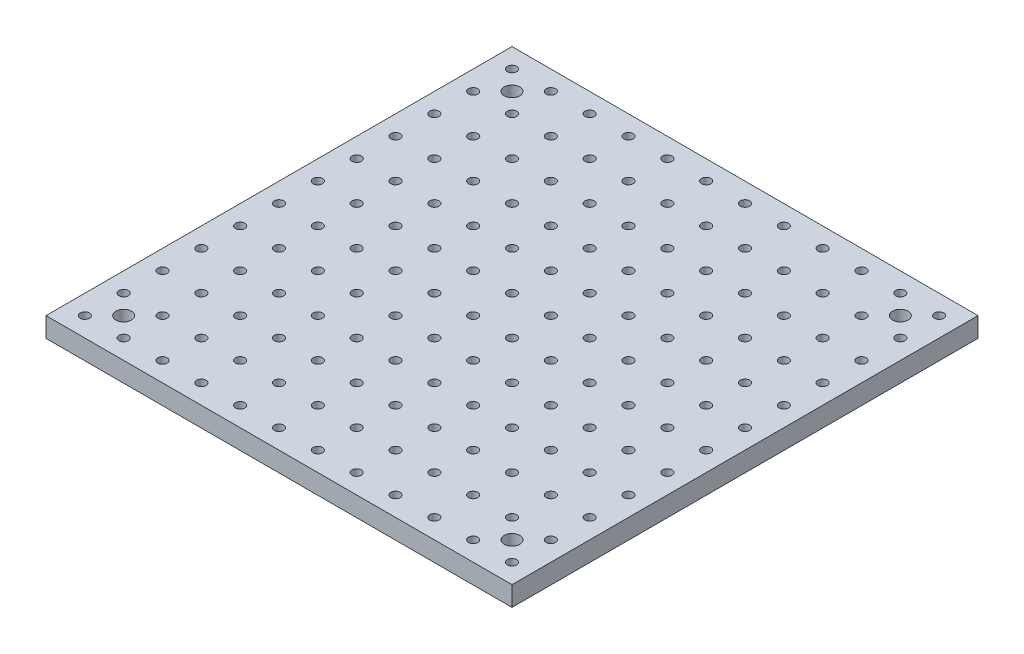
from build123d import *

# Parameters (mm, degrees)
SKETCH1_W           = 300
SKETCH1_H           = 300
BOSS_EXTRUDE1_DEPTH = 12.7
SKETCH2_R           = 3
SKETCH2_R_2         = 5
CUT_EXTRUDE1_DEPTH  = 12.7


with BuildPart() as part:
    # Sketch1 → Boss-Extrude1 (new body)
    with BuildSketch(Plane(origin=(0, 0, 0), x_dir=(1, 0, 0), z_dir=(0, 1, 0))):
        Rectangle(SKETCH1_W, SKETCH1_H)
    extrude(amount=BOSS_EXTRUDE1_DEPTH)

    # Sketch2 → Cut-Extrude1 (cut)
    with BuildSketch(Plane(origin=(0, 12.7, 0), x_dir=(1, 0, 0), z_dir=(0, 1, 0))):
        with Locations(Location((-137.5, -137.5, 0), (0, 0, 270))):
            Circle(SKETCH2_R)
        with Locations(Location((-112.5, -137.5, 0), (0, 0, 270))):
            Circle(SKETCH2_R)
        with Locations(Location((-87.5, -137.5, 0), (0, 0, 270))):
            Circle(SKETCH2_R)
        with Locations(Location((-62.5, -137.5, 0), (0, 0, 270))):
            Circle(SKETCH2_R)
        with Locations(Location((-37.5, -137.5, 0), (0, 0, 270))):
            Circle(SKETCH2_R)
        with Locations(Location((-12.5, -137.5, 0), (0, 0, 270))):
            Circle(SKETCH2_R)
        with Locations(Location((12.5, -137.5, 0), (0, 0, 270))):
            Circle(SKETCH2_R)
        with Locations(Location((37.5, -137.5, 0), (0, 0, 270))):
            Circle(SKETCH2_R)
        with Locations(Location((62.5, -137.5, 0), (0, 0, 270))):
            Circle(SKETCH2_R)
        with Locations(Location((87.5, -137.5, 0), (0, 0, 270))):
            Circle(SKETCH2_R)
        with Locations(Location((112.5, -137.5, 0), (0, 0, 270))):
            Circle(SKETCH2_R)
        with Locations(Location((137.5, -137.5, 0), (0, 0, 270))):
            Circle(SKETCH2_R)
        with Locations(Location((-112.5, -112.5, 0), (0, 0, 270))):
            Circle(SKETCH2_R)
        with Locations(Location((-87.5, -112.5, 0), (0, 0, 270))):
            Circle(SKETCH2_R)
        with Locations(Location((-62.5, -112.5, 0), (0, 0, 270))):
            Circle(SKETCH2_R)
        with Locations(Location((-37.5, -112.5, 0), (0, 0, 270))):
            Circle(SKETCH2_R)
        with Locations(Location((-12.5, -112.5, 0), (0, 0, 270))):
            Circle(SKETCH2_R)
        with Locations(Location((12.5, -112.5, 0), (0, 0, 270))):
            Circle(SKETCH2_R)
        with Locations(Location((37.5, -112.5, 0), (0, 0, 270))):
            Circle(SKETCH2_R)
        with Locations(Location((62.5, -112.5, 0), (0, 0, 270))):
            Circle(SKETCH2_R)
        with Locations(Location((87.5, -112.5, 0), (0, 0, 270))):
            Circle(SKETCH2_R)
        with Locations(Location((112.5, -112.5, 0), (0, 0, 270))):
            Circle(SKETCH2_R)
        with Locations(Location((137.5, -112.5, 0), (0, 0, 270))):
            Circle(SKETCH2_R)
        with Locations(Location((-112.5, -87.5, 0), (0, 0, 270))):
            Circle(SKETCH2_R)
        with Locations(Location((-87.5, -87.5, 0), (0, 0, 270))):
            Circle(SKETCH2_R)
        with Locations(Location((-62.5, -87.5, 0), (0, 0, 270))):
            Circle(SKETCH2_R)
        with Locations(Location((-37.5, -87.5, 0), (0, 0, 270))):
            Circle(SKETCH2_R)
        with Locations(Location((-12.5, -87.5, 0), (0, 0, 270))):
            Circle(SKETCH2_R)
        with Locations(Location((12.5, -87.5, 0), (0, 0, 270))):
            Circle(SKETCH2_R)
        with Locations(Location((37.5, -87.5, 0), (0, 0, 270))):
            Circle(SKETCH2_R)
        with Locations(Location((62.5, -87.5, 0), (0, 0, 270))):
            Circle(SKETCH2_R)
        with Locations(Location((87.5, -87.5, 0), (0, 0, 270))):
            Circle(SKETCH2_R)
        with Locations(Location((112.5, -87.5, 0), (0, 0, 270))):
            Circle(SKETCH2_R)
        with Locations(Location((137.5, -87.5, 0), (0, 0, 270))):
            Circle(SKETCH2_R)
        with Locations(Location((-112.5, -62.5, 0), (0, 0, 270))):
            Circle(SKETCH2_R)
        with Locations(Location((-87.5, -62.5, 0), (0, 0, 270))):
            Circle(SKETCH2_R)
        with Locations(Location((-62.5, -62.5, 0), (0, 0, 270))):
            Circle(SKETCH2_R)
        with Locations(Location((-37.5, -62.5, 0), (0, 0, 270))):
            Circle(SKETCH2_R)
        with Locations(Location((-12.5, -62.5, 0), (0, 0, 270))):
            Circle(SKETCH2_R)
        with Locations(Location((12.5, -62.5, 0), (0, 0, 270))):
            Circle(SKETCH2_R)
        with Locations(Location((37.5, -62.5, 0), (0, 0, 270))):
            Circle(SKETCH2_R)
        with Locations(Location((62.5, -62.5, 0), (0, 0, 270))):
            Circle(SKETCH2_R)
        with Locations(Location((87.5, -62.5, 0), (0, 0, 270))):
            Circle(SKETCH2_R)
        with Locations(Location((112.5, -62.5, 0), (0, 0, 270))):
            Circle(SKETCH2_R)
        with Locations(Location((137.5, -62.5, 0), (0, 0, 270))):
            Circle(SKETCH2_R)
        with Locations(Location((-112.5, -37.5, 0), (0, 0, 270))):
            Circle(SKETCH2_R)
        with Locations(Location((-87.5, -37.5, 0), (0, 0, 270))):
            Circle(SKETCH2_R)
        with Locations(Location((-62.5, -37.5, 0), (0, 0, 270))):
            Circle(SKETCH2_R)
        with Locations(Location((-37.5, -37.5, 0), (0, 0, 270))):
            Circle(SKETCH2_R)
        with Locations(Location((-12.5, -37.5, 0), (0, 0, 270))):
            Circle(SKETCH2_R)
        with Locations(Location((12.5, -37.5, 0), (0, 0, 270))):
            Circle(SKETCH2_R)
        with Locations(Location((37.5, -37.5, 0), (0, 0, 270))):
            Circle(SKETCH2_R)
        with Locations(Location((62.5, -37.5, 0), (0, 0, 270))):
            Circle(SKETCH2_R)
        with Locations(Location((87.5, -37.5, 0), (0, 0, 270))):
            Circle(SKETCH2_R)
        with Locations(Location((112.5, -37.5, 0), (0, 0, 270))):
            Circle(SKETCH2_R)
        with Locations(Location((137.5, -37.5, 0), (0, 0, 270))):
            Circle(SKETCH2_R)
        with Locations(Location((-112.5, -12.5, 0), (0, 0, 270))):
            Circle(SKETCH2_R)
        with Locations(Location((-87.5, -12.5, 0), (0, 0, 270))):
            Circle(SKETCH2_R)
        with Locations(Location((-62.5, -12.5, 0), (0, 0, 270))):
            Circle(SKETCH2_R)
        with Locations(Location((-37.5, -12.5, 0), (0, 0, 270))):
            Circle(SKETCH2_R)
        with Locations(Location((-12.5, -12.5, 0), (0, 0, 270))):
            Circle(SKETCH2_R)
        with Locations(Location((12.5, -12.5, 0), (0, 0, 270))):
            Circle(SKETCH2_R)
        with Locations(Location((37.5, -12.5, 0), (0, 0, 270))):
            Circle(SKETCH2_R)
        with Locations(Location((62.5, -12.5, 0), (0, 0, 270))):
            Circle(SKETCH2_R)
        with Locations(Location((87.5, -12.5, 0), (0, 0, 270))):
            Circle(SKETCH2_R)
        with Locations(Location((112.5, -12.5, 0), (0, 0, 270))):
            Circle(SKETCH2_R)
        with Locations(Location((137.5, -12.5, 0), (0, 0, 270))):
            Circle(SKETCH2_R)
        with Locations(Location((-112.5, 12.5, 0), (0, 0, 270))):
            Circle(SKETCH2_R)
        with Locations(Location((-87.5, 12.5, 0), (0, 0, 270))):
            Circle(SKETCH2_R)
        with Locations(Location((-62.5, 12.5, 0), (0, 0, 270))):
            Circle(SKETCH2_R)
        with Locations(Location((-37.5, 12.5, 0), (0, 0, 270))):
            Circle(SKETCH2_R)
        with Locations(Location((-12.5, 12.5, 0), (0, 0, 270))):
            Circle(SKETCH2_R)
        with Locations(Location((12.5, 12.5, 0), (0, 0, 270))):
            Circle(SKETCH2_R)
        with Locations(Location((37.5, 12.5, 0), (0, 0, 270))):
            Circle(SKETCH2_R)
        with Locations(Location((62.5, 12.5, 0), (0, 0, 270))):
            Circle(SKETCH2_R)
        with Locations(Location((87.5, 12.5, 0), (0, 0, 270))):
            Circle(SKETCH2_R)
        with Locations(Location((112.5, 12.5, 0), (0, 0, 270))):
            Circle(SKETCH2_R)
        with Locations(Location((137.5, 12.5, 0), (0, 0, 270))):
            Circle(SKETCH2_R)
        with Locations(Location((-112.5, 37.5, 0), (0, 0, 270))):
            Circle(SKETCH2_R)
        with Locations(Location((-87.5, 37.5, 0), (0, 0, 270))):
            Circle(SKETCH2_R)
        with Locations(Location((-62.5, 37.5, 0), (0, 0, 270))):
            Circle(SKETCH2_R)
        with Locations(Location((-37.5, 37.5, 0), (0, 0, 270))):
            Circle(SKETCH2_R)
        with Locations(Location((-12.5, 37.5, 0), (0, 0, 270))):
            Circle(SKETCH2_R)
        with Locations(Location((12.5, 37.5, 0), (0, 0, 270))):
            Circle(SKETCH2_R)
        with Locations(Location((37.5, 37.5, 0), (0, 0, 270))):
            Circle(SKETCH2_R)
        with Locations(Location((62.5, 37.5, 0), (0, 0, 270))):
            Circle(SKETCH2_R)
        with Locations(Location((87.5, 37.5, 0), (0, 0, 270))):
            Circle(SKETCH2_R)
        with Locations(Location((112.5, 37.5, 0), (0, 0, 270))):
            Circle(SKETCH2_R)
        with Locations(Location((137.5, 37.5, 0), (0, 0, 270))):
            Circle(SKETCH2_R)
        with Locations(Location((-112.5, 62.5, 0), (0, 0, 270))):
            Circle(SKETCH2_R)
        with Locations(Location((-87.5, 62.5, 0), (0, 0, 270))):
            Circle(SKETCH2_R)
        with Locations(Location((-62.5, 62.5, 0), (0, 0, 270))):
            Circle(SKETCH2_R)
        with Locations(Location((-37.5, 62.5, 0), (0, 0, 270))):
            Circle(SKETCH2_R)
        with Locations(Location((-12.5, 62.5, 0), (0, 0, 270))):
            Circle(SKETCH2_R)
        with Locations(Location((12.5, 62.5, 0), (0, 0, 270))):
            Circle(SKETCH2_R)
        with Locations(Location((37.5, 62.5, 0), (0, 0, 270))):
            Circle(SKETCH2_R)
        with Locations(Location((62.5, 62.5, 0), (0, 0, 270))):
            Circle(SKETCH2_R)
        with Locations(Location((87.5, 62.5, 0), (0, 0, 270))):
            Circle(SKETCH2_R)
        with Locations(Location((112.5, 62.5, 0), (0, 0, 270))):
            Circle(SKETCH2_R)
        with Locations(Location((137.5, 62.5, 0), (0, 0, 270))):
            Circle(SKETCH2_R)
        with Locations(Location((-112.5, 87.5, 0), (0, 0, 270))):
            Circle(SKETCH2_R)
        with Locations(Location((-87.5, 87.5, 0), (0, 0, 270))):
            Circle(SKETCH2_R)
        with Locations(Location((-62.5, 87.5, 0), (0, 0, 270))):
            Circle(SKETCH2_R)
        with Locations(Location((-37.5, 87.5, 0), (0, 0, 270))):
            Circle(SKETCH2_R)
        with Locations(Location((-12.5, 87.5, 0), (0, 0, 270))):
            Circle(SKETCH2_R)
        with Locations(Location((12.5, 87.5, 0), (0, 0, 270))):
            Circle(SKETCH2_R)
        with Locations(Location((37.5, 87.5, 0), (0, 0, 270))):
            Circle(SKETCH2_R)
        with Locations(Location((62.5, 87.5, 0), (0, 0, 270))):
            Circle(SKETCH2_R)
        with Locations(Location((87.5, 87.5, 0), (0, 0, 270))):
            Circle(SKETCH2_R)
        with Locations(Location((112.5, 87.5, 0), (0, 0, 270))):
            Circle(SKETCH2_R)
        with Locations(Location((137.5, 87.5, 0), (0, 0, 270))):
            Circle(SKETCH2_R)
        with Locations(Location((-112.5, 112.5, 0), (0, 0, 270))):
            Circle(SKETCH2_R)
        with Locations(Location((-87.5, 112.5, 0), (0, 0, 270))):
            Circle(SKETCH2_R)
        with Locations(Location((-62.5, 112.5, 0), (0, 0, 270))):
            Circle(SKETCH2_R)
        with Locations(Location((-37.5, 112.5, 0), (0, 0, 270))):
            Circle(SKETCH2_R)
        with Locations(Location((-12.5, 112.5, 0), (0, 0, 270))):
            Circle(SKETCH2_R)
        with Locations(Location((12.5, 112.5, 0), (0, 0, 270))):
            Circle(SKETCH2_R)
        with Locations(Location((37.5, 112.5, 0), (0, 0, 270))):
            Circle(SKETCH2_R)
        with Locations(Location((62.5, 112.5, 0), (0, 0, 270))):
            Circle(SKETCH2_R)
        with Locations(Location((87.5, 112.5, 0), (0, 0, 270))):
            Circle(SKETCH2_R)
        with Locations(Location((112.5, 112.5, 0), (0, 0, 270))):
            Circle(SKETCH2_R)
        with Locations(Location((137.5, 112.5, 0), (0, 0, 270))):
            Circle(SKETCH2_R)
        with Locations(Location((-112.5, 137.5, 0), (0, 0, 270))):
            Circle(SKETCH2_R)
        with Locations(Location((-87.5, 137.5, 0), (0, 0, 270))):
            Circle(SKETCH2_R)
        with Locations(Location((-62.5, 137.5, 0), (0, 0, 270))):
            Circle(SKETCH2_R)
        with Locations(Location((-37.5, 137.5, 0), (0, 0, 270))):
            Circle(SKETCH2_R)
        with Locations(Location((-12.5, 137.5, 0), (0, 0, 270))):
            Circle(SKETCH2_R)
        with Locations(Location((12.5, 137.5, 0), (0, 0, 270))):
            Circle(SKETCH2_R)
        with Locations(Location((37.5, 137.5, 0), (0, 0, 270))):
            Circle(SKETCH2_R)
        with Locations(Location((62.5, 137.5, 0), (0, 0, 270))):
            Circle(SKETCH2_R)
        with Locations(Location((87.5, 137.5, 0), (0, 0, 270))):
            Circle(SKETCH2_R)
        with Locations(Location((112.5, 137.5, 0), (0, 0, 270))):
            Circle(SKETCH2_R)
        with Locations(Location((137.5, 137.5, 0), (0, 0, 270))):
            Circle(SKETCH2_R)
        with Locations(Location((-137.5, -112.5, 0), (0, 0, 270))):
            Circle(SKETCH2_R)
        with Locations(Location((-137.5, -87.5, 0), (0, 0, 270))):
            Circle(SKETCH2_R)
        with Locations(Location((-137.5, -62.5, 0), (0, 0, 270))):
            Circle(SKETCH2_R)
        with Locations(Location((-137.5, -37.5, 0), (0, 0, 270))):
            Circle(SKETCH2_R)
        with Locations(Location((-137.5, -12.5, 0), (0, 0, 270))):
            Circle(SKETCH2_R)
        with Locations(Location((-137.5, 12.5, 0), (0, 0, 270))):
            Circle(SKETCH2_R)
        with Locations(Location((-137.5, 37.5, 0), (0, 0, 270))):
            Circle(SKETCH2_R)
        with Locations(Location((-137.5, 62.5, 0), (0, 0, 270))):
            Circle(SKETCH2_R)
        with Locations(Location((-137.5, 87.5, 0), (0, 0, 270))):
            Circle(SKETCH2_R)
        with Locations(Location((-137.5, 112.5, 0), (0, 0, 270))):
            Circle(SKETCH2_R)
        with Locations(Location((-137.5, 137.5, 0), (0, 0, 270))):
            Circle(SKETCH2_R)
        with Locations(Location((-125, -125, 0), (0, 0, 270))):
            Circle(SKETCH2_R_2)
        with Locations(Location((125, -125, 0), (0, 0, 270))):
            Circle(SKETCH2_R_2)
        with Locations(Location((125, 125, 0), (0, 0, 270))):
            Circle(SKETCH2_R_2)
        with Locations(Location((-125, 125, 0), (0, 0, 270))):
            Circle(SKETCH2_R_2)
    extrude(amount=-CUT_EXTRUDE1_DEPTH, mode=Mode.SUBTRACT)


solid = part.part
